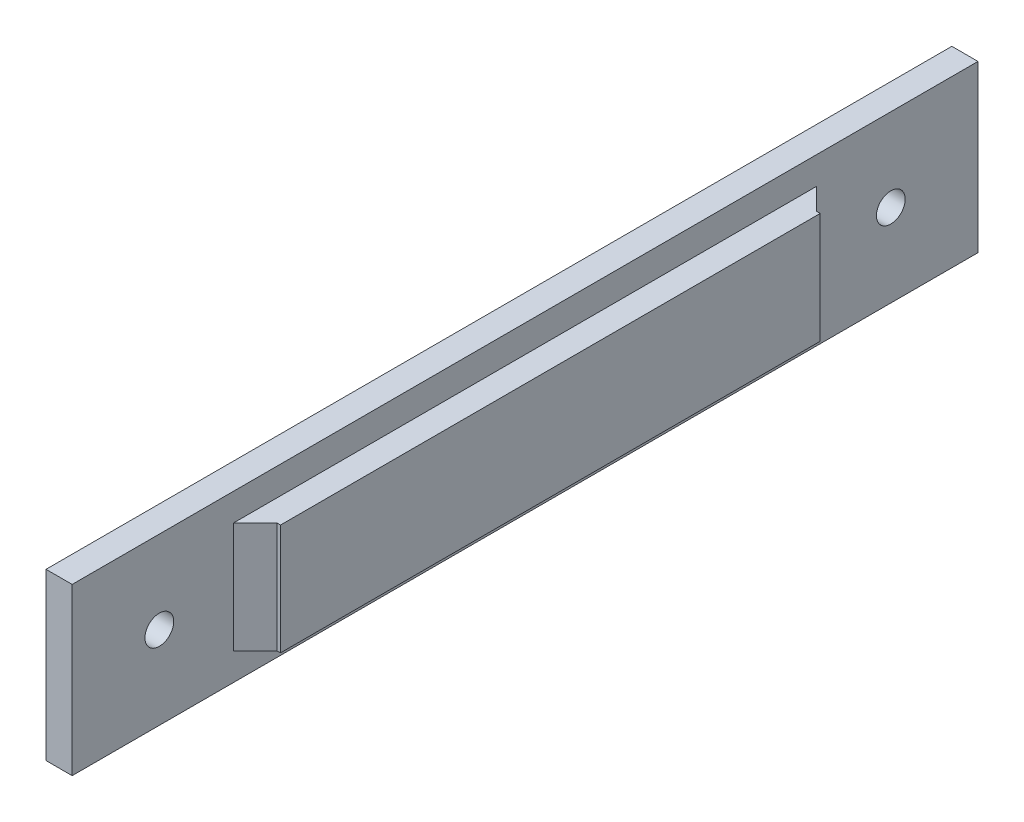
from build123d import *

# Parameters (mm, degrees)
SKETCH_1_W          = 19
SKETCH_1_H          = 19
SKETCH_1_W_2        = 13
SKETCH_1_H_2        = 13
EXTRUDE_1_DEPTH     = 103.9
SKETCH_2_R          = 1.65
CUT_EXTRUDE_1_DEPTH = 30
SKETCH_3_W          = 103.9
SKETCH_3_H          = 19
CUT_EXTRUDE_2_DEPTH = 16
SKETCH_4_W          = 61.9
SKETCH_4_H          = 12.7
EXTRUDE_1_2_DEPTH   = 2.9
CHAMFER_1_SIZE      = 2.5


with BuildPart() as part:
    # 草图1 → Extrude 1 (new body)
    with BuildSketch(Plane.XY):
        with Locations((6.5, 6.5)):
            Rectangle(SKETCH_1_W, SKETCH_1_H)
        with Locations((6.5, 6.5)):
            Rectangle(SKETCH_1_W_2, SKETCH_1_H_2, mode=Mode.SUBTRACT)
    extrude(amount=EXTRUDE_1_DEPTH)

    # 草图2 → 切除-拉伸1 (cut)
    with BuildSketch(Plane.ZY.offset(3)):
        with Locations((10, 6.5)):
            Circle(SKETCH_2_R)
        with Locations((93.9, 6.5)):
            Circle(SKETCH_2_R)
    extrude(amount=-CUT_EXTRUDE_1_DEPTH, mode=Mode.SUBTRACT)

    # 草图3 → 切除-拉伸2 (cut)
    with BuildSketch(Plane(origin=(16, 0, 0), x_dir=(0, 0, -1), z_dir=(1, 0, 0))):
        with Locations((-51.95, 6.5)):
            Rectangle(SKETCH_3_W, SKETCH_3_H)
    extrude(amount=-CUT_EXTRUDE_2_DEPTH, mode=Mode.SUBTRACT)

    # 草图4 → Extrude 1 2 (add)
    with BuildSketch(Plane(origin=(0, 0, 0), x_dir=(0, 0, -1), z_dir=(1, 0, 0))):
        with Locations((-51.95, 6.5)):
            Rectangle(SKETCH_4_W, SKETCH_4_H)
    extrude(amount=EXTRUDE_1_2_DEPTH)

    # 倒角1
    chamfer_1_edges = [part.edges().sort_by_distance(p)[0] for p in [
        (0, 6.5, 82.9),
        (0, 6.5, 21),
    ]]
    chamfer(chamfer_1_edges, length=CHAMFER_1_SIZE)


solid = part.part
